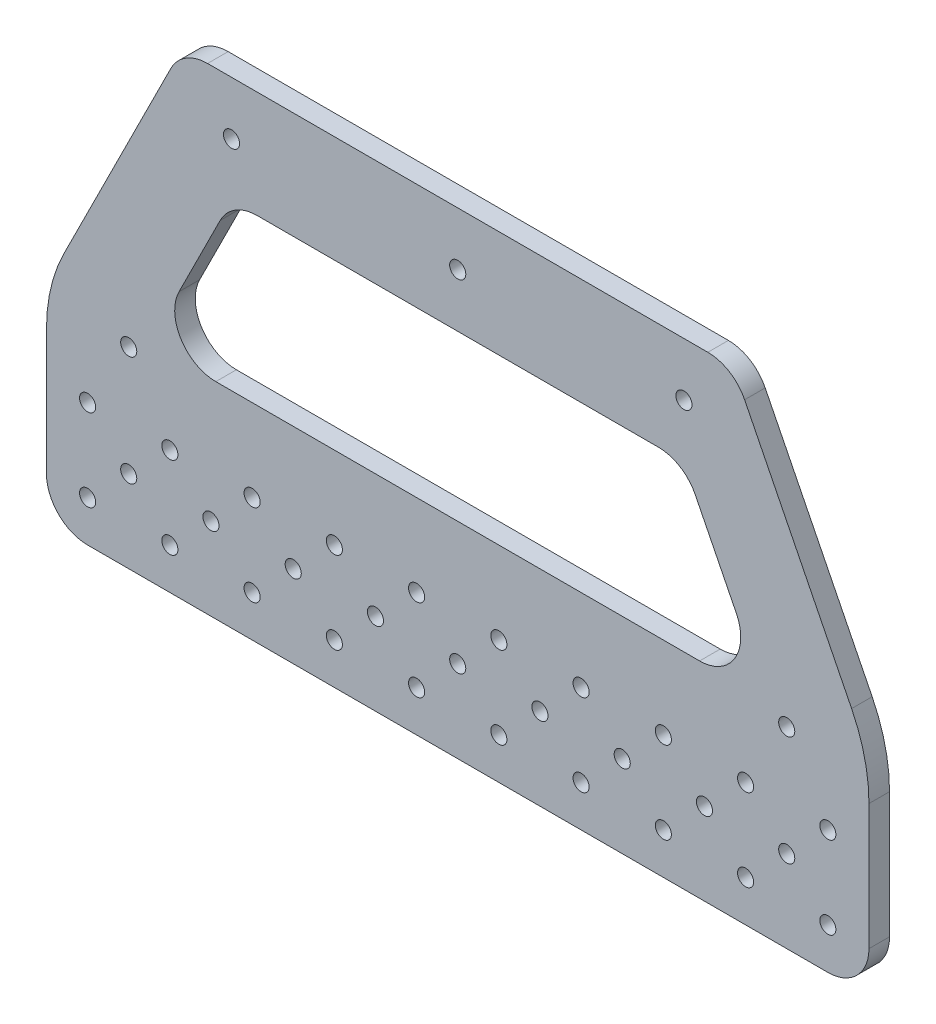
from build123d import *

# Parameters (mm, degrees)
BOSS_EXTRUDE1_DEPTH = 6.35
SKETCH2_R           = 2.4892
CUT_EXTRUDE1_DEPTH  = 294.699684882
SKETCH3_R           = 2.4892
CUT_EXTRUDE2_DEPTH  = 294.699684882


with BuildPart() as part:
    # Sketch1 → Boss-Extrude1 (new body)
    with BuildSketch(Plane.XY):
        with BuildLine():
            Line((12.7, 0), (241.3, 0))
            ThreePointArc((241.3, 0), (250.280256121, 3.719743879), (254, 12.7))
            Line((254, 12.7), (254, 51.507746743))
            ThreePointArc((254, 51.507746743), (252.641048665, 63.179195107), (248.636901303, 74.226197394))
            Line((248.636901303, 74.226197394), (215.600193669, 140.299612663))
            ThreePointArc((215.600193669, 140.299612663), (210.917753467, 145.423265266), (204.240968343, 147.32))
            Line((204.240968343, 147.32), (49.759031657, 147.32))
            ThreePointArc((49.759031657, 147.32), (43.082246533, 145.423265266), (38.399806331, 140.299612663))
            Line((38.399806331, 140.299612663), (5.363098697, 74.226197394))
            ThreePointArc((5.363098697, 74.226197394), (1.358951335, 63.179195107), (0, 51.507746743))
            Line((0, 51.507746743), (0, 12.7))
            ThreePointArc((0, 12.7), (3.719743879, 3.719743879), (12.7, 0))
        make_face()
        with BuildLine():
            Line((40.939806331, 81.879612663), (53.639806331, 107.279612663))
            ThreePointArc((53.639806331, 107.279612663), (58.322246533, 112.403265266), (64.999031657, 114.3))
            Line((64.999031657, 114.3), (189.000968343, 114.3))
            ThreePointArc((189.000968343, 114.3), (195.677753467, 112.403265266), (200.360193669, 107.279612663))
            Line((200.360193669, 107.279612663), (213.060193669, 81.879612663))
            ThreePointArc((213.060193669, 81.879612663), (212.504233609, 69.523214876), (201.700968343, 63.5))
            Line((201.700968343, 63.5), (52.299031657, 63.5))
            ThreePointArc((52.299031657, 63.5), (41.495766391, 69.523214876), (40.939806331, 81.879612663))
        make_face(mode=Mode.SUBTRACT)
    extrude(amount=BOSS_EXTRUDE1_DEPTH)

    # Sketch2 → Cut-Extrude1 (cut, through all)
    with BuildSketch(Plane.XY.offset(6.35)):
        with Locations((241.3, 12.7)):
            Circle(SKETCH2_R)
        with Locations((215.9, 12.7)):
            Circle(SKETCH2_R)
        with Locations((190.5, 12.7)):
            Circle(SKETCH2_R)
        with Locations((165.1, 12.7)):
            Circle(SKETCH2_R)
        with Locations((139.7, 12.7)):
            Circle(SKETCH2_R)
        with Locations((114.3, 12.7)):
            Circle(SKETCH2_R)
        with Locations((88.9, 12.7)):
            Circle(SKETCH2_R)
        with Locations((63.5, 12.7)):
            Circle(SKETCH2_R)
        with Locations((38.1, 12.7)):
            Circle(SKETCH2_R)
        with Locations((12.7, 12.7)):
            Circle(SKETCH2_R)
        with Locations((215.9, 38.1)):
            Circle(SKETCH2_R)
        with Locations((190.5, 38.1)):
            Circle(SKETCH2_R)
        with Locations((165.1, 38.1)):
            Circle(SKETCH2_R)
        with Locations((139.7, 38.1)):
            Circle(SKETCH2_R)
        with Locations((114.3, 38.1)):
            Circle(SKETCH2_R)
        with Locations((88.9, 38.1)):
            Circle(SKETCH2_R)
        with Locations((63.5, 38.1)):
            Circle(SKETCH2_R)
        with Locations((38.1, 38.1)):
            Circle(SKETCH2_R)
        with Locations((12.7, 38.1)):
            Circle(SKETCH2_R)
        with Locations((241.3, 38.1)):
            Circle(SKETCH2_R)
        with Locations((25.4, 25.4)):
            Circle(SKETCH2_R)
        with Locations((50.8, 25.4)):
            Circle(SKETCH2_R)
        with Locations((76.2, 25.4)):
            Circle(SKETCH2_R)
        with Locations((101.6, 25.4)):
            Circle(SKETCH2_R)
        with Locations((127, 25.4)):
            Circle(SKETCH2_R)
        with Locations((152.4, 25.4)):
            Circle(SKETCH2_R)
        with Locations((177.8, 25.4)):
            Circle(SKETCH2_R)
        with Locations((203.2, 25.4)):
            Circle(SKETCH2_R)
        with Locations((228.6, 25.4)):
            Circle(SKETCH2_R)
    extrude(amount=-CUT_EXTRUDE1_DEPTH, mode=Mode.SUBTRACT)

    # Sketch3 → Cut-Extrude2 (cut, through all)
    with BuildSketch(Plane.XY.offset(6.35)):
        with Locations((57.15, 130.81)):
            Circle(SKETCH3_R)
        with Locations((127, 130.81)):
            Circle(SKETCH3_R)
        with Locations((196.85, 130.81)):
            Circle(SKETCH3_R)
        with Locations((228.6, 59.332735968)):
            Circle(SKETCH3_R)
        with Locations((25.4, 59.332735968)):
            Circle(SKETCH3_R)
    extrude(amount=-CUT_EXTRUDE2_DEPTH, mode=Mode.SUBTRACT)


solid = part.part
